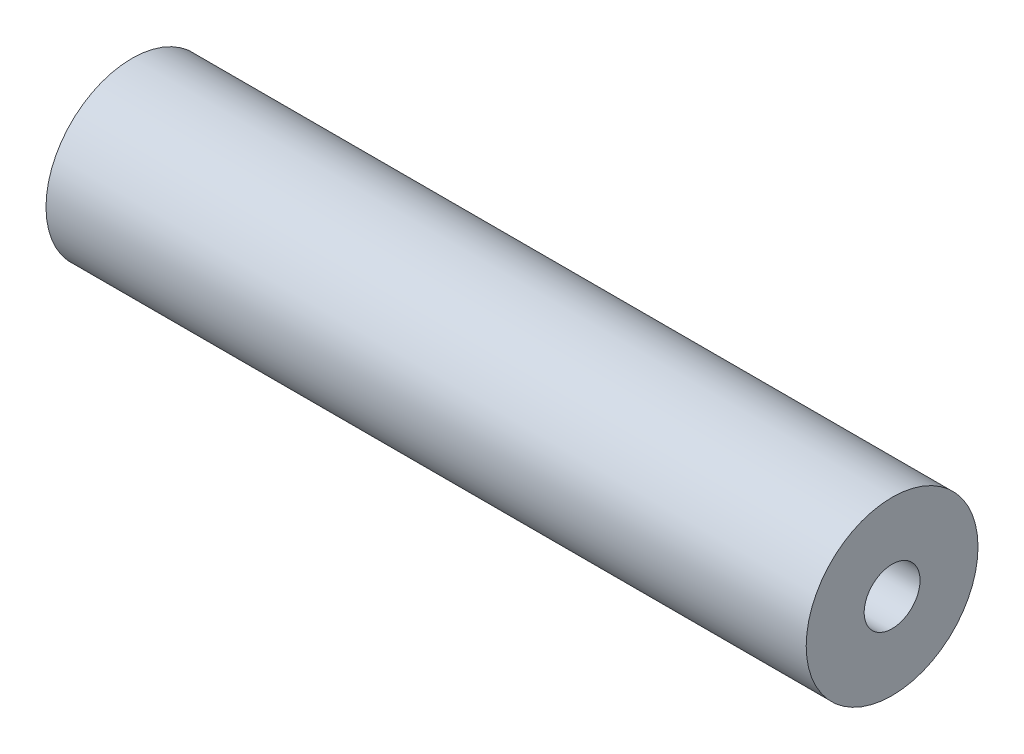
from build123d import *

# Parameters (mm, degrees)
SKETCH_1_R          = 4
EXTRUDE_1_DEPTH     = 35.4
SKETCH_2_R          = 1.3
CUT_EXTRUDE_1_DEPTH = 12
CUT_EXTRUDE_START   = -12
SKETCH_3_R          = 1.3
CUT_EXTRUDE_2_DEPTH = 12


with BuildPart() as part:
    # ｽｹｯﾁ1 → ﾎﾞｽ - 押し出し1 (new body)
    with BuildSketch(Plane(origin=(0, 0, 0), x_dir=(0, 0, -1), z_dir=(1, 0, 0))):
        Circle(SKETCH_1_R)
    extrude(amount=EXTRUDE_1_DEPTH)

    # ｽｹｯﾁ2 → ｶｯﾄ - 押し出し1 (cut)
    with BuildSketch(Plane(origin=(35.4, 0, 0), x_dir=(0, 0, -1), z_dir=(1, 0, 0))):
        Circle(SKETCH_2_R)
    extrude(amount=-CUT_EXTRUDE_1_DEPTH, mode=Mode.SUBTRACT)

    # ｽｹｯﾁ3 → ｶｯﾄ - 押し出し2 (cut)
    with BuildSketch(Plane.ZY.offset(CUT_EXTRUDE_START)):
        with Locations(Location((0, 0, 0), (0, 0, 180))):
            Circle(SKETCH_3_R)
    extrude(amount=CUT_EXTRUDE_2_DEPTH, mode=Mode.SUBTRACT)


solid = part.part
